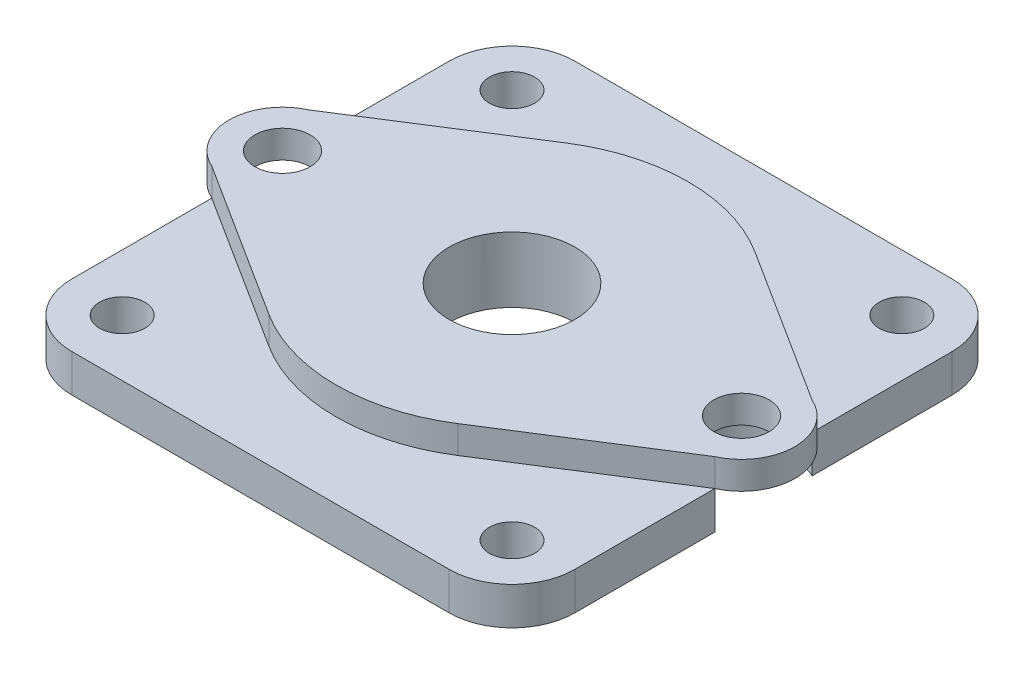
from build123d import *

# Parameters (mm, degrees)
SKETCH_1_R          = 1.8
SKETCH_1_R_2        = 5
EXTRUDE_1_DEPTH     = 3
EXTRUDE_2_DEPTH     = 2.2
SKETCH_3_R          = 5
CUT_EXTRUDE_1_DEPTH = 2.2
EXTRUDE_4_DEPTH     = 2.2
EXTRUDE_5_DEPTH     = 2.2


with BuildPart() as part:
    # 草图1 → 凸台-拉伸1 (new body)
    with BuildSketch(Plane(origin=(0, 0, 0), x_dir=(1, 0, 0), z_dir=(0, 1, 0))):
        with BuildLine():
            Line((20, -3.872983346), (20, -15))
            ThreePointArc((20, -15), (18.535533906, -18.535533906), (15, -20))
            Line((15, -20), (-15, -20))
            ThreePointArc((-15, -20), (-18.535533906, -18.535533906), (-20, -15))
            Line((-20, -15), (-20, -3.872983346))
            ThreePointArc((-20, -3.872983346), (-14, 0), (-20, 3.872983346))
            Line((-20, 3.872983346), (-20, 15))
            ThreePointArc((-20, 15), (-18.535533906, 18.535533906), (-15, 20))
            Line((-15, 20), (15, 20))
            ThreePointArc((15, 20), (18.535533906, 18.535533906), (20, 15))
            Line((20, 15), (20, 3.872983346))
            ThreePointArc((20, 3.872983346), (14, 0), (20, -3.872983346))
        make_face()
        with Locations(Location((-15.5, 15.5, 0), (0, 0, 270))):
            Circle(SKETCH_1_R, mode=Mode.SUBTRACT)
        with Locations(Location((15.5, 15.5, 0), (0, 0, 270))):
            Circle(SKETCH_1_R, mode=Mode.SUBTRACT)
        with Locations(Location((-15.5, -15.5, 0), (0, 0, 270))):
            Circle(SKETCH_1_R, mode=Mode.SUBTRACT)
        with Locations(Location((15.5, -15.5, 0), (0, 0, 270))):
            Circle(SKETCH_1_R, mode=Mode.SUBTRACT)
        with Locations(Location((0, 0, 0), (0, 0, 270))):
            Circle(SKETCH_1_R_2, mode=Mode.SUBTRACT)
    extrude(amount=EXTRUDE_1_DEPTH)

    # 草图2 → 凸台-拉伸2 (add)
    with BuildSketch(Plane(origin=(0, 3, 0), x_dir=(1, 0, 0), z_dir=(0, 1, 0))):
        with BuildLine():
            Line((-20, 3.872983346), (-7.512267775, 11.81379841))
            ThreePointArc((-7.512267775, 11.81379841), (0, 14), (7.512267775, 11.81379841))
            Line((7.512267775, 11.81379841), (20, 3.872983346))
            Line((20, 3.872983346), (20, 1.333229163))
            ThreePointArc((20, 1.333229163), (16.05, 0), (20, -1.333229163))
            Line((20, -1.333229163), (20, -3.872983346))
            Line((20, -3.872983346), (7.512267775, -11.81379841))
            ThreePointArc((7.512267775, -11.81379841), (0, -14), (-7.512267775, -11.81379841))
            Line((-7.512267775, -11.81379841), (-20, -3.872983346))
            Line((-20, -3.872983346), (-20, -1.333229163))
            ThreePointArc((-20, -1.333229163), (-16.05, 0), (-20, 1.333229163))
            Line((-20, 1.333229163), (-20, 3.872983346))
        make_face()
    extrude(amount=EXTRUDE_2_DEPTH)

    # 草图3 → 切除-拉伸1 (cut)
    with BuildSketch(Plane.XZ.offset(-3)):
        with Locations(Location((0, 0, 0), (0, 0, 270))):
            Circle(SKETCH_3_R)
    extrude(amount=-CUT_EXTRUDE_1_DEPTH, mode=Mode.SUBTRACT)

    # 草图4 → 凸台-拉伸4 (add)
    with BuildSketch(Plane.XZ.offset(-3)):
        with BuildLine():
            Line((20, 3.872983346), (20, 1.333229163))
            ThreePointArc((20, 1.333229163), (20.45, 0), (20, -1.333229163))
            Line((20, -1.333229163), (20, -3.872983346))
            ThreePointArc((20, -3.872983346), (22.5, 0), (20, 3.872983346))
        make_face()
    extrude(amount=-EXTRUDE_4_DEPTH)

    # 草图5 → 凸台-拉伸5 (add)
    with BuildSketch(Plane.XZ.offset(-3)):
        with BuildLine():
            Line((-20, 3.872983346), (-20, 1.333229163))
            ThreePointArc((-20, 1.333229163), (-20.45, 0), (-20, -1.333229163))
            Line((-20, -1.333229163), (-20, -3.872983346))
            ThreePointArc((-20, -3.872983346), (-22.5, 0), (-20, 3.872983346))
        make_face()
    extrude(amount=-EXTRUDE_5_DEPTH)


solid = part.part
